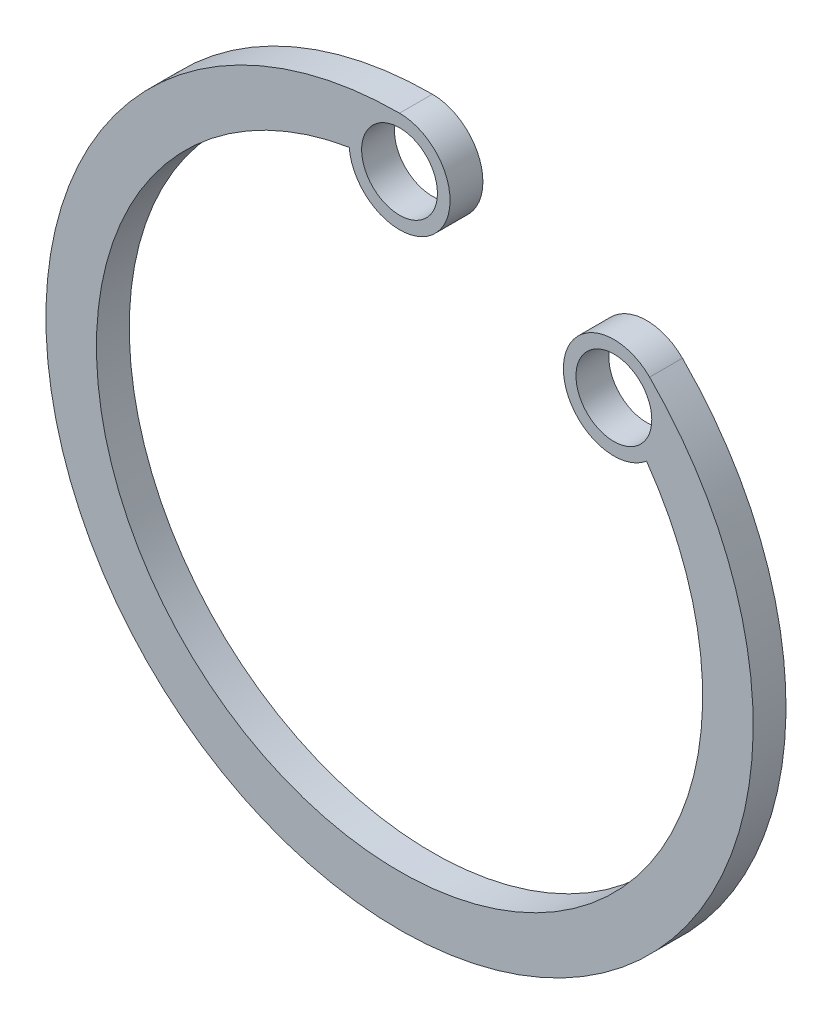
from build123d import *

# Parameters (mm, degrees)
SKETCH1_R           = 1.5
BOSS_EXTRUDE1_DEPTH = 1.3


with BuildPart() as part:
    # Sketch1 → Boss-Extrude1 (new body)
    with BuildSketch(Plane.XY):
        with BuildLine():
            ThreePointArc((0, 14), (-5.357568055, -12.934313455), (9.899494939, 9.899494934))
            ThreePointArc((9.899494939, 9.899494934), (6.487021267, 8.568687268), (9.776724788, 6.9581357))
            ThreePointArc((9.776724788, 6.9581357), (-4.592201188, -11.08655439), (-1.993043457, 11.833333333))
            ThreePointArc((-1.993043457, 11.833333333), (1.471960144, 10.645993599), (0, 14))
        make_face()
        with Locations((0, 12)):
            Circle(SKETCH1_R, mode=Mode.SUBTRACT)
        with Locations((8.485281374, 8.485281374)):
            Circle(SKETCH1_R, mode=Mode.SUBTRACT)
    extrude(amount=BOSS_EXTRUDE1_DEPTH)


solid = part.part
